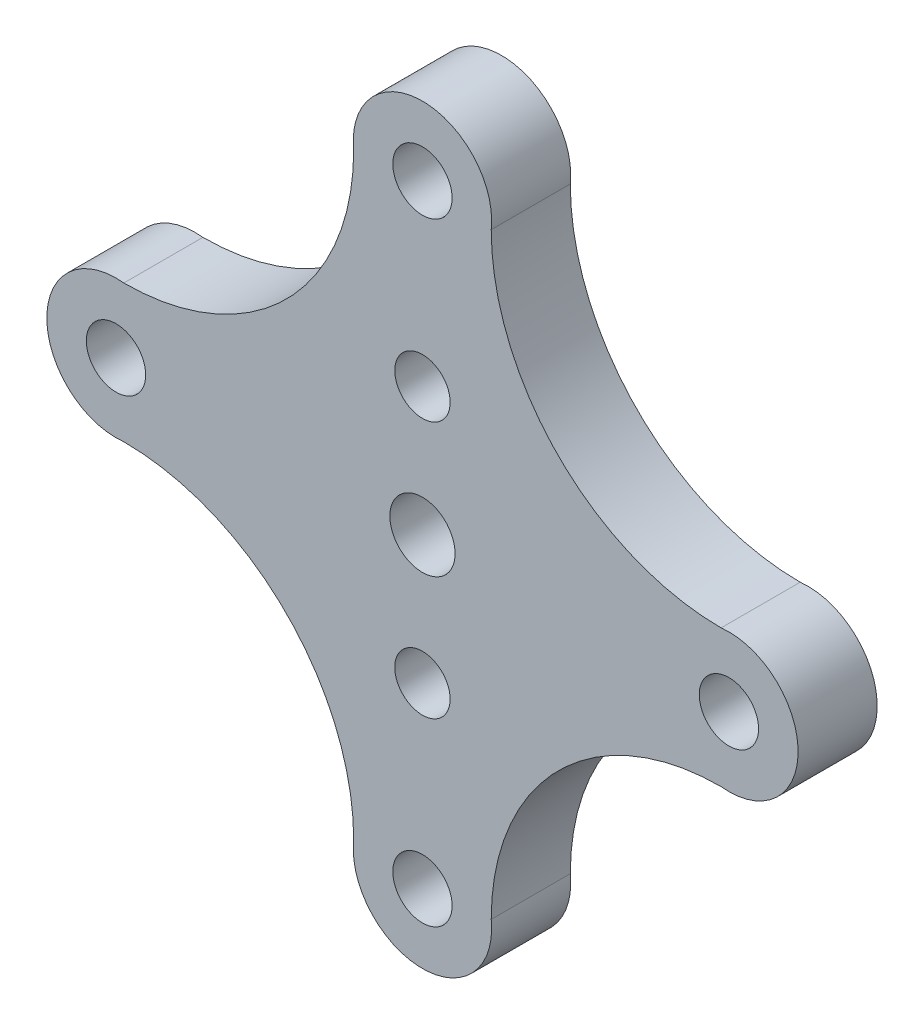
from build123d import *

# Parameters (mm, degrees)
SKETCH_1_R      = 1.65
SKETCH_1_R_2    = 1.4
SKETCH_1_R_3    = 1.5
EXTRUDE_1_DEPTH = 4


with BuildPart() as part:
    # 草图1 → 凸台-拉伸1 (new body)
    with BuildSketch(Plane.XY):
        with BuildLine():
            ThreePointArc((-3.477620962, -15.10483871), (0, -19), (3.477620962, -15.10483871))
            ThreePointArc((3.477620962, -15.10483871), (6.883154194, -6.883154194), (15.10483871, -3.477620962))
            ThreePointArc((15.10483871, -3.477620962), (19, 0), (15.10483871, 3.477620962))
            ThreePointArc((15.10483871, 3.477620962), (6.883154194, 6.883154194), (3.477620962, 15.10483871))
            ThreePointArc((3.477620962, 15.10483871), (0, 19), (-3.477620962, 15.10483871))
            ThreePointArc((-3.477620962, 15.10483871), (-6.883154194, 6.883154194), (-15.10483871, 3.477620962))
            ThreePointArc((-15.10483871, 3.477620962), (-19, 0), (-15.10483871, -3.477620962))
            ThreePointArc((-15.10483871, -3.477620962), (-6.883154194, -6.883154194), (-3.477620962, -15.10483871))
        make_face()
        Circle(SKETCH_1_R, mode=Mode.SUBTRACT)
        with Locations((0, -6.5)):
            Circle(SKETCH_1_R_2, mode=Mode.SUBTRACT)
        with Locations((0, 6.5)):
            Circle(SKETCH_1_R_2, mode=Mode.SUBTRACT)
        with Locations((0, -15.5)):
            Circle(SKETCH_1_R_3, mode=Mode.SUBTRACT)
        with Locations((-15.5, 0)):
            Circle(SKETCH_1_R_3, mode=Mode.SUBTRACT)
        with Locations((0, 15.5)):
            Circle(SKETCH_1_R_3, mode=Mode.SUBTRACT)
        with Locations((15.5, 0)):
            Circle(SKETCH_1_R_3, mode=Mode.SUBTRACT)
    extrude(amount=EXTRUDE_1_DEPTH)


solid = part.part
